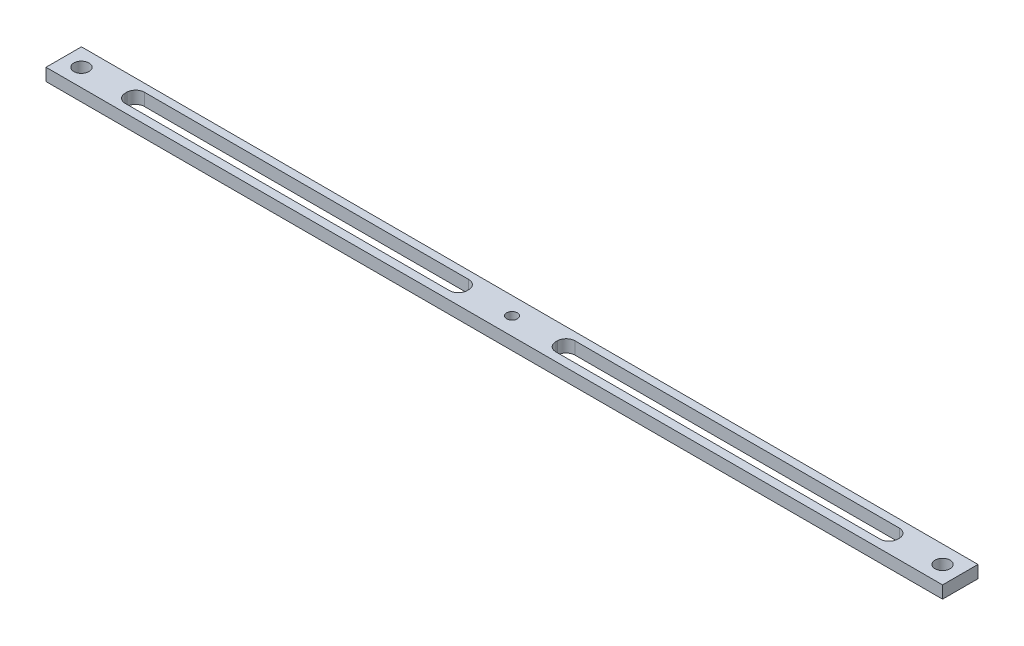
from build123d import *

# Parameters (mm, degrees)
SZKIC1_W                    = 506
SZKIC1_H                    = 20
SZKIC1_R                    = 3
SZKIC1_R_2                  = 4.25
DODANIE_WYCI_GNI_CIE1_DEPTH = 7


with BuildPart() as part:
    # Szkic1 → Dodanie-wyciągnięcie1 (new body)
    with BuildSketch(Plane(origin=(0, 0, 0), x_dir=(1, 0, 0), z_dir=(0, 1, 0))):
        with Locations((253, 10)):
            Rectangle(SZKIC1_W, SZKIC1_H)
        with Locations(Location((253, 10, 0), (0, 0, 270))):
            Circle(SZKIC1_R, mode=Mode.SUBTRACT)
        with Locations(Location((10, 10, 0), (0, 0, 270))):
            Circle(SZKIC1_R_2, mode=Mode.SUBTRACT)
        with Locations(Location((496, 10, 0), (0, 0, 270))):
            Circle(SZKIC1_R_2, mode=Mode.SUBTRACT)
        with BuildLine():
            Line((40, 15.57457628), (223, 15.57457628))
            ThreePointArc((223, 15.57457628), (226.535533906, 14.110110186), (228, 10.57457628))
            Line((228, 10.57457628), (228, 9.696719379))
            ThreePointArc((228, 9.696719379), (226.535533906, 6.161185473), (223, 4.696719379))
            Line((223, 4.696719379), (40, 4.696719379))
            ThreePointArc((40, 4.696719379), (36.464466094, 6.161185473), (35, 9.696719379))
            Line((35, 9.696719379), (35, 10.57457628))
            ThreePointArc((35, 10.57457628), (36.464466094, 14.110110186), (40, 15.57457628))
        make_face(mode=Mode.SUBTRACT)
        with BuildLine():
            Line((283, 15.57457628), (466, 15.57457628))
            ThreePointArc((466, 15.57457628), (469.535533906, 14.110110186), (471, 10.57457628))
            Line((471, 10.57457628), (471, 9.752776346))
            ThreePointArc((471, 9.752776346), (469.535533906, 6.21724244), (466, 4.752776346))
            Line((466, 4.752776346), (283, 4.752776346))
            ThreePointArc((283, 4.752776346), (279.464466094, 6.21724244), (278, 9.752776346))
            Line((278, 9.752776346), (278, 10.57457628))
            ThreePointArc((278, 10.57457628), (279.464466094, 14.110110186), (283, 15.57457628))
        make_face(mode=Mode.SUBTRACT)
    extrude(amount=DODANIE_WYCI_GNI_CIE1_DEPTH)


solid = part.part
